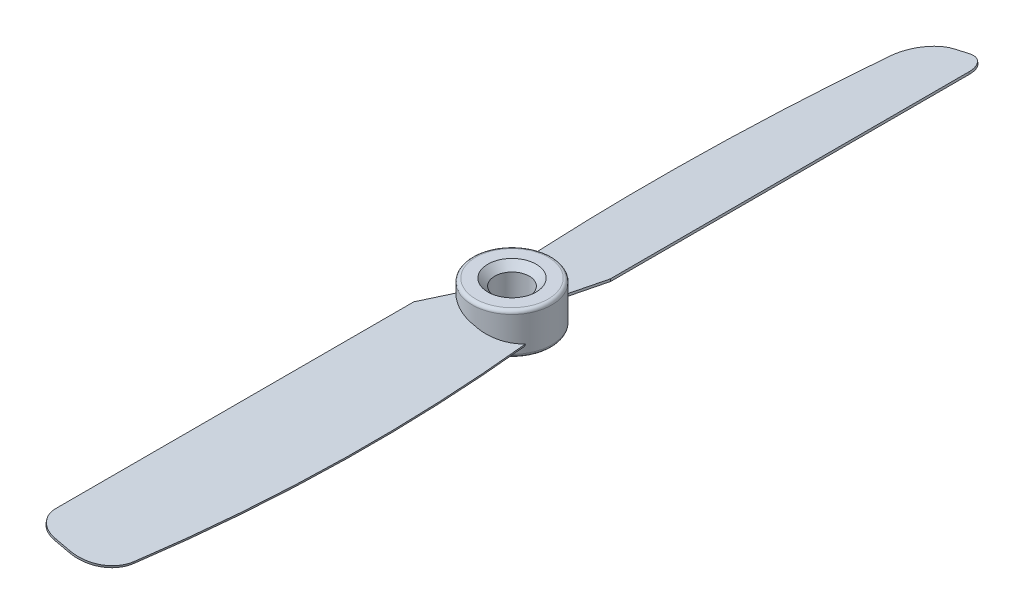
from build123d import *

# Parameters (mm, degrees)
SKETCH1_R           = 5.75
BOSS_EXTRUDE1_DEPTH = 3
BOSS_EXTRUDE2_DEPTH = 0.15
CIRPATTERN1_COUNT   = 2
SKETCH4_R           = 2.5
CUT_EXTRUDE1_DEPTH  = 65.083925427
FILLET1_R           = 0.5
CHAMFER1_SIZE       = 1


with BuildPart() as part:
    # Sketch1 → Boss-Extrude1 (new, symmetric)
    with BuildSketch(Plane(origin=(0, 0, 0), x_dir=(1, 0, 0), z_dir=(0, 1, 0))):
        with Locations(Location((0, 0, 0), (0, 0, 270))):
            Circle(SKETCH1_R)
    extrude(amount=BOSS_EXTRUDE1_DEPTH, both=True)

    # Sketch3 → Boss-Extrude2 (add, symmetric)
    with BuildSketch(Plane(origin=(0, 0, 0), x_dir=(0.9743700647852351, -0.22495105434386545, 0), z_dir=(-0.22495105434386545, -0.9743700647852351, 0))):
        with BuildLine():
            Line((-3.946096789, 3.251337345), (-5.859151844, 8.548605509))
            Line((-5.859151844, 8.548605509), (-5.859151844, 60.5))
            ThreePointArc((-5.859151844, 60.5), (-4.980472188, 62.621320344), (-2.859151844, 63.5))
            Line((-2.859151844, 63.5), (-0.550434398, 63.5))
            ThreePointArc((-0.550434398, 63.5), (2.768651687, 62.239474236), (4.414220363, 59.093467024))
            add(Edge.make_bspline(
                [(5.295803115, 3.251337345), (6.928408565, 21.891598877), (6.634212966, 40.522095073), (4.414220363, 59.093467024)],
                knots=[0, 0, 0, 0, 0.926692818, 0.926692818, 0.926692818, 0.926692818], degree=3))
            add(Edge.make_bspline(
                [(5.295803115, 3.251337345), (0.674853163, 10.168892518), (-3.946096789, 3.251337345)],
                knots=[5.313367698, 5.313367698, 5.313367698, 7.253002917, 7.253002917, 7.253002917], degree=2, weights=[1, 0.565449973, 1]))
        make_face()
    boss_extrude2 = extrude(amount=BOSS_EXTRUDE2_DEPTH, both=True)

    # CirPattern1: Boss-Extrude2 ×2 about axis
    cirpattern1_axis = Axis((0, 3, 0), (0, 1, 0))
    for i in range(1, CIRPATTERN1_COUNT):
        add(boss_extrude2.rotate(cirpattern1_axis, i * 360 / CIRPATTERN1_COUNT))

    # Sketch4 → Cut-Extrude1 (cut, through all)
    with BuildSketch(Plane(origin=(0, 3, 0), x_dir=(1, 0, 0), z_dir=(0, 1, 0))):
        with Locations(Location((0, 0, 0), (0, 0, 270))):
            Circle(SKETCH4_R)
    extrude(amount=-CUT_EXTRUDE1_DEPTH, mode=Mode.SUBTRACT)

    # Fillet1
    fillet1_edges = [part.edges().sort_by_distance(p)[0] for p in [
        (0, -3, -5.75),
        (0, 3, -5.75),
    ]]
    fillet(fillet1_edges, radius=FILLET1_R)

    # Chamfer1
    chamfer1_edges = [part.edges().sort_by_distance(p)[0] for p in [
        (0, -3, -2.5),
        (0, 3, -2.5),
    ]]
    chamfer(chamfer1_edges, length=CHAMFER1_SIZE)


solid = part.part
